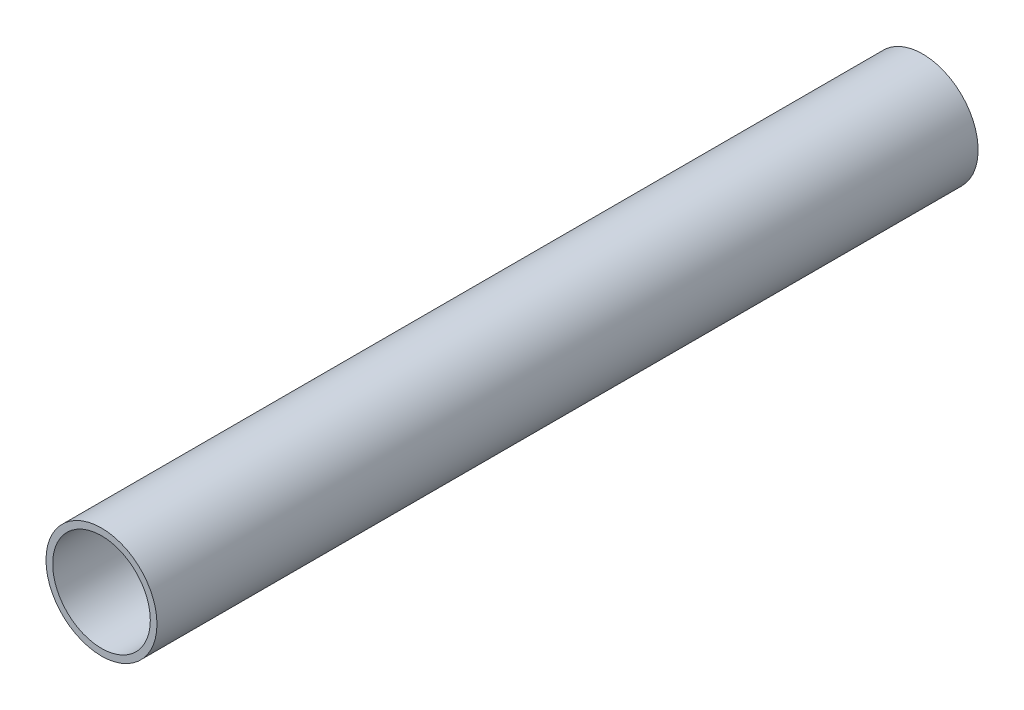
from build123d import *

# Parameters (mm, degrees)
SKETCH_1_R           = 12.5
EXTRUDE_2_DEPTH      = 235.43
SKETCH_2_R           = 9
CUT_EXTRUDE_1_DEPTH  = 235.43
EXTRUDE_START        = 15.57
SKETCH_3_R           = 12.5
EXTRUDE_3_DEPTH      = 15.57
SKETCH_4_R           = 9
CUT_EXTRUDE_2_DEPTH  = 20
EXTRUDE_START_2      = 9.93
SKETCH_5_R           = 12.5
EXTRUDE_4_DEPTH      = 9.93
SKETCH_6_R           = 9
CUT_EXTRUDE_3_DEPTH  = 10
SKETCH_7_R           = 26.85848727
CUT_EXTRUDE_4_DEPTH  = 14.93
SKETCH_8_R           = 12.5
EXTRUDE_5_DEPTH      = 9.93
SKETCH_9_R           = 9
CUT_EXTRUDE_5_DEPTH  = 10
SKETCH_10_R          = 37.193394561
CUT_EXTRUDE_6_DEPTH  = 0.22
SKETCH_11_R          = 43.187188263
CUT_EXTRUDE_7_DEPTH  = 0.71
SKETCH_12_R          = 12.5
EXTRUDE_6_DEPTH      = 15
CUT_EXTRUDE_START    = -15
SKETCH_13_R          = 9
CUT_EXTRUDE_8_DEPTH  = 15
SKETCH_14_R          = 46.427055536
CUT_EXTRUDE_9_DEPTH  = 85
SKETCH_15_R          = 11
CUT_EXTRUDE_10_DEPTH = 324


with BuildPart() as part:
    # 草图1 → 凸台-拉伸2 (new body)
    with BuildSketch(Plane.XY):
        Circle(SKETCH_1_R)
    extrude(amount=EXTRUDE_2_DEPTH)

    # 草图2 → 切除-拉伸1 (cut)
    with BuildSketch(Plane(origin=(0, 0, 0), x_dir=(-1, 0, 0), z_dir=(0, 0, -1))):
        Circle(SKETCH_2_R)
    extrude(amount=-CUT_EXTRUDE_1_DEPTH, mode=Mode.SUBTRACT)

    # 草图3 → 凸台-拉伸3 (add)
    with BuildSketch(Plane(origin=(0, 0, 0), x_dir=(-1, 0, 0), z_dir=(0, 0, -1)).offset(EXTRUDE_START)):
        Circle(SKETCH_3_R)
    extrude(amount=-EXTRUDE_3_DEPTH)

    # 草图4 → 切除-拉伸2 (cut)
    with BuildSketch(Plane(origin=(0, 0, -15.57), x_dir=(-1, 0, 0), z_dir=(0, 0, -1))):
        Circle(SKETCH_4_R)
    extrude(amount=-CUT_EXTRUDE_2_DEPTH, mode=Mode.SUBTRACT)

    # 草图5 → 凸台-拉伸4 (add)
    with BuildSketch(Plane(origin=(0, 0, -15.57), x_dir=(-1, 0, 0), z_dir=(0, 0, -1)).offset(EXTRUDE_START_2)):
        Circle(SKETCH_5_R)
    extrude(amount=-EXTRUDE_4_DEPTH)

    # 草图6 → 切除-拉伸3 (cut)
    with BuildSketch(Plane(origin=(0, 0, -25.5), x_dir=(-1, 0, 0), z_dir=(0, 0, -1))):
        Circle(SKETCH_6_R)
    extrude(amount=-CUT_EXTRUDE_3_DEPTH, mode=Mode.SUBTRACT)

    # 草图7 → 切除-拉伸4 (cut)
    with BuildSketch(Plane(origin=(0, 0, -25.5), x_dir=(-1, 0, 0), z_dir=(0, 0, -1))):
        Circle(SKETCH_7_R)
    extrude(amount=-CUT_EXTRUDE_4_DEPTH, mode=Mode.SUBTRACT)

    # 草图8 → 凸台-拉伸5 (add)
    with BuildSketch(Plane(origin=(0, 0, -10.57), x_dir=(-1, 0, 0), z_dir=(0, 0, -1)).offset(EXTRUDE_START_2)):
        Circle(SKETCH_8_R)
    extrude(amount=-EXTRUDE_5_DEPTH)

    # 草图9 → 切除-拉伸5 (cut)
    with BuildSketch(Plane(origin=(0, 0, -20.5), x_dir=(-1, 0, 0), z_dir=(0, 0, -1))):
        Circle(SKETCH_9_R)
    extrude(amount=-CUT_EXTRUDE_5_DEPTH, mode=Mode.SUBTRACT)

    # 草图10 → 切除-拉伸6 (cut)
    with BuildSketch(Plane(origin=(0, 0, -20.5), x_dir=(-1, 0, 0), z_dir=(0, 0, -1))):
        with Locations((7.201744855, 7.507888779)):
            Circle(SKETCH_10_R)
    extrude(amount=-CUT_EXTRUDE_6_DEPTH, mode=Mode.SUBTRACT)

    # 草图11 → 切除-拉伸7 (cut)
    with BuildSketch(Plane(origin=(0, 0, -20.28), x_dir=(-1, 0, 0), z_dir=(0, 0, -1))):
        with Locations((-1.225460352, 2.329416421)):
            Circle(SKETCH_11_R)
    extrude(amount=-CUT_EXTRUDE_7_DEPTH, mode=Mode.SUBTRACT)

    # 草图12 → 凸台-拉伸6 (add)
    with BuildSketch(Plane.XY.offset(235.43)):
        with Locations(Location((0, 0, 0), (0, 0, 180))):
            Circle(SKETCH_12_R)
    extrude(amount=EXTRUDE_6_DEPTH)

    # 草图13 → 切除-拉伸8 (cut)
    with BuildSketch(Plane.XY.offset(250.43).offset(CUT_EXTRUDE_START)):
        with Locations(Location((0, 0, 0), (0, 0, 180))):
            Circle(SKETCH_13_R)
    extrude(amount=CUT_EXTRUDE_8_DEPTH, mode=Mode.SUBTRACT)

    # 草图14 → 切除-拉伸9 (cut)
    with BuildSketch(Plane.XY.offset(250.43)):
        with Locations((-6.064552421, 3.817147789)):
            Circle(SKETCH_14_R)
    extrude(amount=-CUT_EXTRUDE_9_DEPTH, mode=Mode.SUBTRACT)

    # 草图15 → 切除-拉伸10 (cut)
    with BuildSketch(Plane.XY.offset(165.43)):
        Circle(SKETCH_15_R)
    extrude(amount=-CUT_EXTRUDE_10_DEPTH, mode=Mode.SUBTRACT)


solid = part.part
